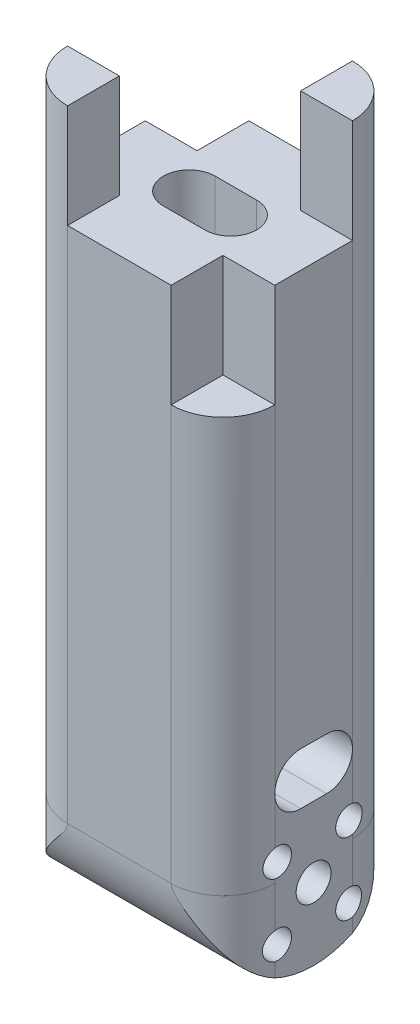
from build123d import *

# Parameters (mm, degrees)
ESQUISSE3_W                  = 40
ESQUISSE3_H                  = 35
BOSS_EXTRU_2_DEPTH           = 120
CONG_1_R                     = 10
ENL_V_MAT_EXTRU_1_DEPTH      = 20
ESQUISSE5_W                  = 10
ESQUISSE5_H                  = 10
ENL_V_MAT_EXTRU_2_DEPTH      = 20
ENL_V_MAT_EXTRU_3_DEPTH      = 90
BOSS_EXTRU_3_DEPTH           = 40
ENL_V_MAT_EXTRU_4_DEPTH      = 60
ENL_V_MAT_EXTRU_5_DEPTH      = 6.8
ENL_V_MAT_EXTRU_5_DEPTH_BACK = 123.907485563
ESQUISSE10_W                 = 7.2
ESQUISSE10_H                 = 21.1
ENL_V_MAT_EXTRU_6_DEPTH      = 128.695927936
ESQUISSE12_W                 = 13
ESQUISSE12_H                 = 45.255241282
ENL_V_MAT_EXTRU_7_DEPTH      = 6
TROUS_DE_CENTRAGE_1_0MM1_D   = 6.74688
D_GAGEMENT_M51_D             = 5.5
D_GAGEMENT_M51_DEPTH         = 12
D_GAGEMENT_M51_TIP           = 1.652366702
D_GAGEMENT_M52_D             = 5.3
D_GAGEMENT_M52_DEPTH         = 12
D_GAGEMENT_M52_TIP           = 1.59228064


with BuildPart() as part:
    # Esquisse3 → Boss.-Extru.2 (new body)
    with BuildSketch(Plane(origin=(0, 0, 0), x_dir=(1, 0, 0), z_dir=(0, 1, 0))):
        Rectangle(ESQUISSE3_W, ESQUISSE3_H)
    extrude(amount=BOSS_EXTRU_2_DEPTH)

    # Congé1
    cong_1_edges = [part.edges().sort_by_distance(p)[0] for p in [
        (20, 60, 17.5),
        (-20, 60, 17.5),
        (-20, 60, -17.5),
        (20, 60, -17.5),
    ]]
    fillet(cong_1_edges, radius=CONG_1_R)

    # Esquisse4 → Enlèv. mat.-Extru.1 (cut)
    with BuildSketch(Plane(origin=(0, 120, 0), x_dir=(1, 0, 0), z_dir=(0, 1, 0))):
        Polygon((-10, 17.5), (10, 17.5), (10, 7.5), (20, 7.5), (20, -17.5), (-10, -17.5), (-10, -7.5), (-20, -7.5), (-20, 17.5), align=None)
    extrude(amount=-ENL_V_MAT_EXTRU_1_DEPTH, mode=Mode.SUBTRACT)

    # Esquisse5 → Enlèv. mat.-Extru.2 (cut)
    with BuildSketch(Plane(origin=(0, 100, 0), x_dir=(1, 0, 0), z_dir=(0, 1, 0))):
        with Locations((-15, 12.5)):
            Rectangle(ESQUISSE5_W, ESQUISSE5_H)
        with Locations((15, -12.5)):
            Rectangle(ESQUISSE5_W, ESQUISSE5_H)
    extrude(amount=-ENL_V_MAT_EXTRU_2_DEPTH, mode=Mode.SUBTRACT)

    # Esquisse6 → Enlèv. mat.-Extru.3 (cut)
    with BuildSketch(Plane(origin=(0, 100, 0), x_dir=(1, 0, 0), z_dir=(0, 1, 0))):
        with BuildLine():
            Line((-4, 5), (4, 5))
            ThreePointArc((4, 5), (9, 0), (4, -5))
            Line((4, -5), (-4, -5))
            ThreePointArc((-4, -5), (-9, 0), (-4, 5))
        make_face()
    extrude(amount=-ENL_V_MAT_EXTRU_3_DEPTH, mode=Mode.SUBTRACT)

    # Esquisse8 → Boss.-Extru.3 (add)
    with BuildSketch(Plane.ZY.offset(20)):
        with BuildLine():
            Line((-17.5, 0), (17.5, 0))
            ThreePointArc((17.5, 0), (0, -17.5), (-17.5, 0))
        make_face()
    extrude(amount=-BOSS_EXTRU_3_DEPTH)

    # Esquisse9 → Enlèv. mat.-Extru.4 (cut)
    with BuildSketch(Plane(origin=(0, 0, 0), x_dir=(1, 0, 0), z_dir=(0, 1, 0))):
        with BuildLine():
            Line((-10, 17.5), (-20, 17.5))
            Line((-20, 17.5), (-20, 7.5))
            add(Edge.make_bspline(
                [(-20, 7.5), (-19.142135624, 16.642135624), (-10, 17.5)],
                knots=[0, 0, 0, 1, 1, 1], degree=2))
        make_face()
        with BuildLine():
            Line((10, 17.5), (20, 17.5))
            Line((20, 17.5), (20, 7.5))
            add(Edge.make_bspline(
                [(10, 17.5), (19.142135624, 16.642135624), (20, 7.5)],
                knots=[0, 0, 0, 1, 1, 1], degree=2))
        make_face()
        with BuildLine():
            Line((-20, -7.5), (-20, -17.5))
            Line((-20, -17.5), (-10, -17.5))
            add(Edge.make_bspline(
                [(-20, -7.5), (-19.142135624, -16.642135624), (-10, -17.5)],
                knots=[0, 0, 0, 1, 1, 1], degree=2))
        make_face()
        with BuildLine():
            Line((10, -17.5), (20, -17.5))
            Line((20, -17.5), (20, -7.5))
            add(Edge.make_bspline(
                [(20, -7.5), (19.142135624, -16.642135624), (10, -17.5)],
                knots=[0, 0, 0, 1, 1, 1], degree=2))
        make_face()
    extrude(amount=-ENL_V_MAT_EXTRU_4_DEPTH, mode=Mode.SUBTRACT)

    # Esquisse10 → Enlèv. mat.-Extru.5 (cut, two sides: drawn at the far end of the back side and taken through both)
    with BuildSketch(Plane(origin=(0, 0, 0), x_dir=(1, 0, 0), z_dir=(0, 1, 0)).offset(-ENL_V_MAT_EXTRU_5_DEPTH_BACK)):
        with Locations((-6.15, 0)):
            Rectangle(ESQUISSE10_W, ESQUISSE10_H)
        with Locations((6.15, 0)):
            Rectangle(ESQUISSE10_W, ESQUISSE10_H)
    extrude(amount=ENL_V_MAT_EXTRU_5_DEPTH + ENL_V_MAT_EXTRU_5_DEPTH_BACK, mode=Mode.SUBTRACT)

    # Esquisse11 → Enlèv. mat.-Extru.6 (cut, through all)
    with BuildSketch(Plane(origin=(20, 0, 0), x_dir=(0, 0, -1), z_dir=(1, 0, 0))):
        with BuildLine():
            Line((-2.5, 20), (2.5, 20))
            ThreePointArc((2.5, 20), (7.5, 15), (2.5, 10))
            Line((2.5, 10), (-2.5, 10))
            ThreePointArc((-2.5, 10), (-7.5, 15), (-2.5, 20))
        make_face()
    extrude(amount=-ENL_V_MAT_EXTRU_6_DEPTH, mode=Mode.SUBTRACT)

    # Esquisse12 → Enlèv. mat.-Extru.7 (cut)
    with BuildSketch(Plane(origin=(2.55, 0, 0), x_dir=(0, 0, -1), z_dir=(1, 0, 0))):
        with Locations((0, -17.5)):
            Rectangle(ESQUISSE12_W, ESQUISSE12_H)
    extrude(amount=-ENL_V_MAT_EXTRU_7_DEPTH, mode=Mode.SUBTRACT)

    # Trous de centrage Ø1.0mm1 (through all)
    with Locations(Plane(origin=(20, 0, 0), x_dir=(0, 0, -1), z_dir=(1, 0, 0))):
        with Locations((0, -3.6)):
            Hole(TROUS_DE_CENTRAGE_1_0MM1_D / 2)

    # Dégagement M51
    with Locations(Plane.ZY.offset(20)):
        with Locations((-6.915, -10.515), (-6.915, 3.315), (6.915, 3.315), (6.915, -10.515)):
            Hole(D_GAGEMENT_M51_D / 2, depth=D_GAGEMENT_M51_DEPTH)
            with Locations((0, 0, -(D_GAGEMENT_M51_DEPTH + D_GAGEMENT_M51_TIP / 2))):  # 118° drill point
                Cone(0, D_GAGEMENT_M51_D / 2, D_GAGEMENT_M51_TIP, mode=Mode.SUBTRACT)

    # Dégagement M52
    with Locations(Plane(origin=(20, 0, 0), x_dir=(0, 0, -1), z_dir=(1, 0, 0))):
        with Locations((-6.915, -10.515), (6.915, -10.515), (6.915, 3.315), (-6.915, 3.315)):
            Hole(D_GAGEMENT_M52_D / 2, depth=D_GAGEMENT_M52_DEPTH)
            with Locations((0, 0, -(D_GAGEMENT_M52_DEPTH + D_GAGEMENT_M52_TIP / 2))):  # 118° drill point
                Cone(0, D_GAGEMENT_M52_D / 2, D_GAGEMENT_M52_TIP, mode=Mode.SUBTRACT)


solid = part.part
